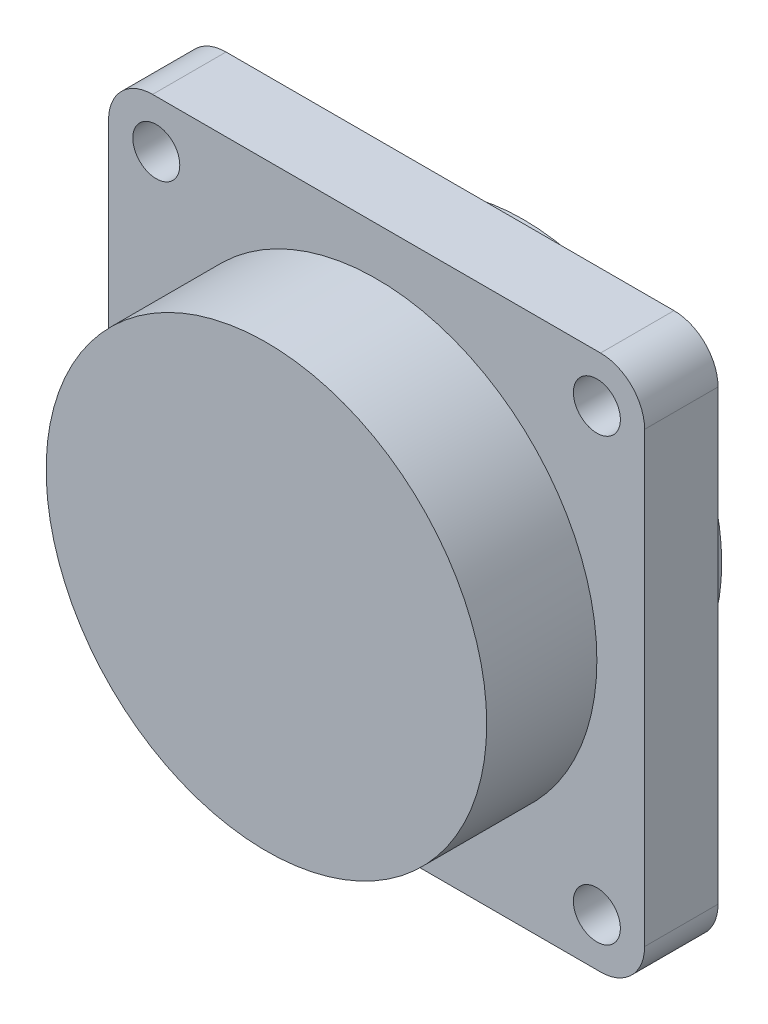
from build123d import *

# Parameters (mm, degrees)
SKETCH_1_W          = 36.5
SKETCH_1_H          = 36.5
EXTRUDE_1_DEPTH     = 5
SKETCH_2_R          = 15
EXTRUDE_2_DEPTH     = 7.5
SKETCH_3_R          = 13.5
EXTRUDE_3_DEPTH     = 5
SKETCH_4_R          = 1.6
CUT_EXTRUDE_1_DEPTH = 29.677081441
FILLET_1_R          = 3


with BuildPart() as part:
    # 草图1 → 凸台-拉伸1 (new body)
    with BuildSketch(Plane.XY):
        Rectangle(SKETCH_1_W, SKETCH_1_H)
    extrude(amount=EXTRUDE_1_DEPTH)

    # 草图2 → 凸台-拉伸2 (add)
    with BuildSketch(Plane.XY.offset(5)):
        Circle(SKETCH_2_R)
    extrude(amount=EXTRUDE_2_DEPTH)

    # 草图3 → 凸台-拉伸3 (add)
    with BuildSketch(Plane(origin=(0, 0, 0), x_dir=(-1, 0, 0), z_dir=(0, 0, -1))):
        with Locations(Location((0, 0, 0), (0, 0, 180))):
            Circle(SKETCH_3_R)
    extrude(amount=EXTRUDE_3_DEPTH)

    # 草图4 → 切除-拉伸1 (cut, through all)
    with BuildSketch(Plane(origin=(0, 0, 0), x_dir=(-1, 0, 0), z_dir=(0, 0, -1))):
        with Locations((-15, 15)):
            Circle(SKETCH_4_R)
        with Locations(Location((-15, -15, 0), (0, 0, 180))):
            Circle(SKETCH_4_R)
        with Locations((15, -15)):
            Circle(SKETCH_4_R)
        with Locations(Location((15, 15, 0), (0, 0, 180))):
            Circle(SKETCH_4_R)
    extrude(amount=-CUT_EXTRUDE_1_DEPTH, mode=Mode.SUBTRACT)

    # 圆角1
    fillet_1_edges = [part.edges().sort_by_distance(p)[0] for p in [
        (-18.25, 18.25, 2.5),
        (18.25, 18.25, 2.5),
        (18.25, -18.25, 2.5),
        (-18.25, -18.25, 2.5),
    ]]
    fillet(fillet_1_edges, radius=FILLET_1_R)


solid = part.part
